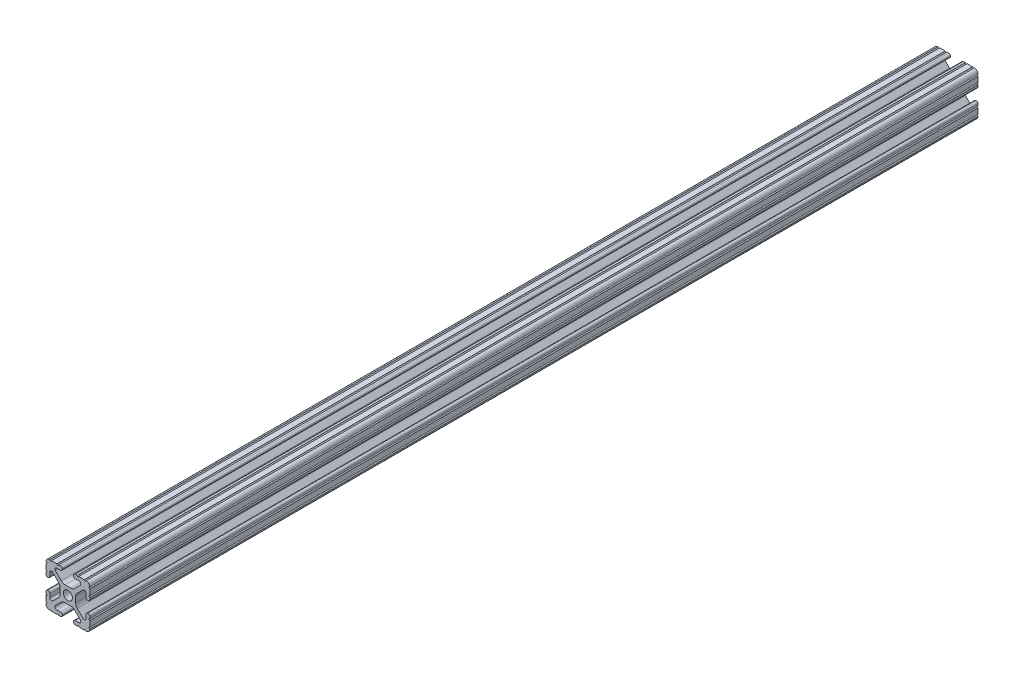
from build123d import *

# Parameters (mm, degrees)
SKETCH1_R           = 2.6035
BOSS_EXTRUDE1_DEPTH = 304.8
SKETCH2_W           = 31.141643918
SKETCH2_H           = 31.372180197
CUT_EXTRUDE1_DEPTH  = 94.234


with BuildPart() as part:
    # Sketch1 → Boss-Extrude1 (new, symmetric)
    with BuildSketch(Plane.XY):
        with BuildLine():
            Line((-7.179650497, -8.645192506), (-3.952270251, -5.423690499))
            ThreePointArc((-3.952270251, -5.423690499), (-2.922936451, -4.736929036), (-1.709253557, -4.4958))
            Line((-1.709253557, -4.4958), (1.709253557, -4.4958))
            ThreePointArc((1.709253557, -4.4958), (2.922936451, -4.736929036), (3.952270251, -5.423690499))
            Line((3.952270251, -5.423690499), (7.179650497, -8.645192506))
            ThreePointArc((7.179650497, -8.645192506), (7.41473083, -9.822813117), (6.416408329, -10.4902))
            Line((6.416408329, -10.4902), (4.287512407, -10.4902))
            ThreePointArc((4.287512407, -10.4902), (3.54574862, -10.79744862), (3.2385, -11.539212407))
            Line((3.2385, -11.539212407), (3.2385, -11.650987593))
            ThreePointArc((3.2385, -11.650987593), (3.54574862, -12.39275138), (4.287512407, -12.7))
            Line((4.287512407, -12.7), (5.317126718, -12.7))
            ThreePointArc((5.317126718, -12.7), (5.825126718, -12.192), (6.333126718, -12.7))
            Line((6.333126718, -12.7), (9.550443118, -12.7))
            ThreePointArc((9.550443118, -12.7), (10.058366869, -12.192000006), (10.566443095, -12.699847501))
            ThreePointArc((10.566443095, -12.699847501), (12.082537762, -12.08250727), (12.699846982, -10.566399977))
            ThreePointArc((12.699846982, -10.566399977), (12.192000006, -10.058323491), (12.7, -9.5504))
            Line((12.7, -9.5504), (12.7, -6.3330836))
            ThreePointArc((12.7, -6.3330836), (12.192, -5.8250836), (12.7, -5.3170836))
            Line((12.7, -5.3170836), (12.7, -4.287469289))
            ThreePointArc((12.7, -4.287469289), (12.39275138, -3.545705502), (11.650987593, -3.238456882))
            Line((11.650987593, -3.238456882), (11.539212407, -3.238456882))
            ThreePointArc((11.539212407, -3.238456882), (10.79744862, -3.545705502), (10.4902, -4.287469289))
            Line((10.4902, -4.287469289), (10.4902, -6.402089023))
            ThreePointArc((10.4902, -6.402089023), (9.856505071, -7.351067942), (8.737131347, -7.129408934))
            Line((8.737131347, -7.129408934), (5.441005833, -3.840816462))
            ThreePointArc((5.441005833, -3.840816462), (4.750877967, -2.809883091), (4.5085, -1.593185507))
            Line((4.5085, -1.593185507), (4.5085, 1.593185507))
            ThreePointArc((4.5085, 1.593185507), (4.750877967, 2.809883091), (5.441005833, 3.840816462))
            Line((5.441005833, 3.840816462), (8.737131347, 7.129408934))
            ThreePointArc((8.737131347, 7.129408934), (9.856505071, 7.351067942), (10.4902, 6.402089023))
            Line((10.4902, 6.402089023), (10.4902, 4.287469289))
            ThreePointArc((10.4902, 4.287469289), (10.79744862, 3.545705502), (11.539212407, 3.238456882))
            Line((11.539212407, 3.238456882), (11.650987593, 3.238456882))
            ThreePointArc((11.650987593, 3.238456882), (12.39275138, 3.545705502), (12.7, 4.287469289))
            Line((12.7, 4.287469289), (12.7, 5.3170836))
            ThreePointArc((12.7, 5.3170836), (12.192, 5.8250836), (12.7, 6.3330836))
            Line((12.7, 6.3330836), (12.7, 9.5504))
            ThreePointArc((12.7, 9.5504), (12.192000006, 10.058323491), (12.699846982, 10.566399977))
            ThreePointArc((12.699846982, 10.566399977), (12.082537762, 12.08250727), (10.566443095, 12.699847501))
            ThreePointArc((10.566443095, 12.699847501), (10.058366869, 12.192000006), (9.550443118, 12.7))
            Line((9.550443118, 12.7), (6.333126718, 12.7))
            ThreePointArc((6.333126718, 12.7), (5.825126718, 12.192), (5.317126718, 12.7))
            Line((5.317126718, 12.7), (4.287512407, 12.7))
            ThreePointArc((4.287512407, 12.7), (3.54574862, 12.39275138), (3.2385, 11.650987593))
            Line((3.2385, 11.650987593), (3.2385, 11.539212407))
            ThreePointArc((3.2385, 11.539212407), (3.54574862, 10.79744862), (4.287512407, 10.4902))
            Line((4.287512407, 10.4902), (6.476788598, 10.4902))
            ThreePointArc((6.476788598, 10.4902), (7.432222385, 9.85140422), (7.207036008, 8.724370562))
            Line((7.207036008, 8.724370562), (3.898272566, 5.423169045))
            ThreePointArc((3.898272566, 5.423169045), (2.869120213, 4.736787962), (1.655778399, 4.4958))
            Line((1.655778399, 4.4958), (-1.655778399, 4.4958))
            ThreePointArc((-1.655778399, 4.4958), (-2.869120213, 4.736787962), (-3.898272566, 5.423169045))
            Line((-3.898272566, 5.423169045), (-7.207036008, 8.724370562))
            ThreePointArc((-7.207036008, 8.724370562), (-7.432222385, 9.85140422), (-6.476788598, 10.4902))
            Line((-6.476788598, 10.4902), (-4.287512407, 10.4902))
            ThreePointArc((-4.287512407, 10.4902), (-3.54574862, 10.79744862), (-3.2385, 11.539212407))
            Line((-3.2385, 11.539212407), (-3.2385, 11.650987593))
            ThreePointArc((-3.2385, 11.650987593), (-3.54574862, 12.39275138), (-4.287512407, 12.7))
            Line((-4.287512407, 12.7), (-5.317126718, 12.7))
            ThreePointArc((-5.317126718, 12.7), (-5.825126718, 12.192), (-6.333126718, 12.7))
            Line((-6.333126718, 12.7), (-9.550443118, 12.7))
            ThreePointArc((-9.550443118, 12.7), (-10.058366869, 12.192000006), (-10.566443095, 12.699847501))
            ThreePointArc((-10.566443095, 12.699847501), (-12.082537762, 12.08250727), (-12.699846982, 10.566399977))
            ThreePointArc((-12.699846982, 10.566399977), (-12.192000006, 10.058323491), (-12.7, 9.5504))
            Line((-12.7, 9.5504), (-12.7, 6.3330836))
            ThreePointArc((-12.7, 6.3330836), (-12.192, 5.8250836), (-12.7, 5.3170836))
            Line((-12.7, 5.3170836), (-12.7, 4.287469289))
            ThreePointArc((-12.7, 4.287469289), (-12.39275138, 3.545705502), (-11.650987593, 3.238456882))
            Line((-11.650987593, 3.238456882), (-11.539212407, 3.238456882))
            ThreePointArc((-11.539212407, 3.238456882), (-10.79744862, 3.545705502), (-10.4902, 4.287469289))
            Line((-10.4902, 4.287469289), (-10.4902, 6.402089023))
            ThreePointArc((-10.4902, 6.402089023), (-9.856505071, 7.351067942), (-8.737131347, 7.129408934))
            Line((-8.737131347, 7.129408934), (-5.441005833, 3.840816462))
            ThreePointArc((-5.441005833, 3.840816462), (-4.750877967, 2.809883091), (-4.5085, 1.593185507))
            Line((-4.5085, 1.593185507), (-4.5085, -1.593185507))
            ThreePointArc((-4.5085, -1.593185507), (-4.750877967, -2.809883091), (-5.441005833, -3.840816462))
            Line((-5.441005833, -3.840816462), (-8.737131347, -7.129408934))
            ThreePointArc((-8.737131347, -7.129408934), (-9.856505071, -7.351067942), (-10.4902, -6.402089023))
            Line((-10.4902, -6.402089023), (-10.4902, -4.287469289))
            ThreePointArc((-10.4902, -4.287469289), (-10.79744862, -3.545705502), (-11.539212407, -3.238456882))
            Line((-11.539212407, -3.238456882), (-11.650987593, -3.238456882))
            ThreePointArc((-11.650987593, -3.238456882), (-12.39275138, -3.545705502), (-12.7, -4.287469289))
            Line((-12.7, -4.287469289), (-12.7, -5.3170836))
            ThreePointArc((-12.7, -5.3170836), (-12.192, -5.8250836), (-12.7, -6.3330836))
            Line((-12.7, -6.3330836), (-12.7, -9.5504))
            ThreePointArc((-12.7, -9.5504), (-12.192000006, -10.058323491), (-12.699846982, -10.566399977))
            ThreePointArc((-12.699846982, -10.566399977), (-12.082537762, -12.08250727), (-10.566443095, -12.699847501))
            ThreePointArc((-10.566443095, -12.699847501), (-10.058366869, -12.192000006), (-9.550443118, -12.7))
            Line((-9.550443118, -12.7), (-6.333126718, -12.7))
            ThreePointArc((-6.333126718, -12.7), (-5.825126718, -12.192), (-5.317126718, -12.7))
            Line((-5.317126718, -12.7), (-4.287512407, -12.7))
            ThreePointArc((-4.287512407, -12.7), (-3.54574862, -12.39275138), (-3.2385, -11.650987593))
            Line((-3.2385, -11.650987593), (-3.2385, -11.539212407))
            ThreePointArc((-3.2385, -11.539212407), (-3.54574862, -10.79744862), (-4.287512407, -10.4902))
            Line((-4.287512407, -10.4902), (-6.416408329, -10.4902))
            ThreePointArc((-6.416408329, -10.4902), (-7.41473083, -9.822813117), (-7.179650497, -8.645192506))
        make_face()
        with Locations(Location((0, 0, 0), (0, 0, 180))):
            Circle(SKETCH1_R, mode=Mode.SUBTRACT)
    extrude(amount=BOSS_EXTRUDE1_DEPTH, both=True)

    # Sketch2 → Cut-Extrude1 (cut)
    with BuildSketch(Plane.XY.offset(304.8)):
        with Locations((0.193871266, 0.656875365)):
            Rectangle(SKETCH2_W, SKETCH2_H)
    extrude(amount=-CUT_EXTRUDE1_DEPTH, mode=Mode.SUBTRACT)


solid = part.part
